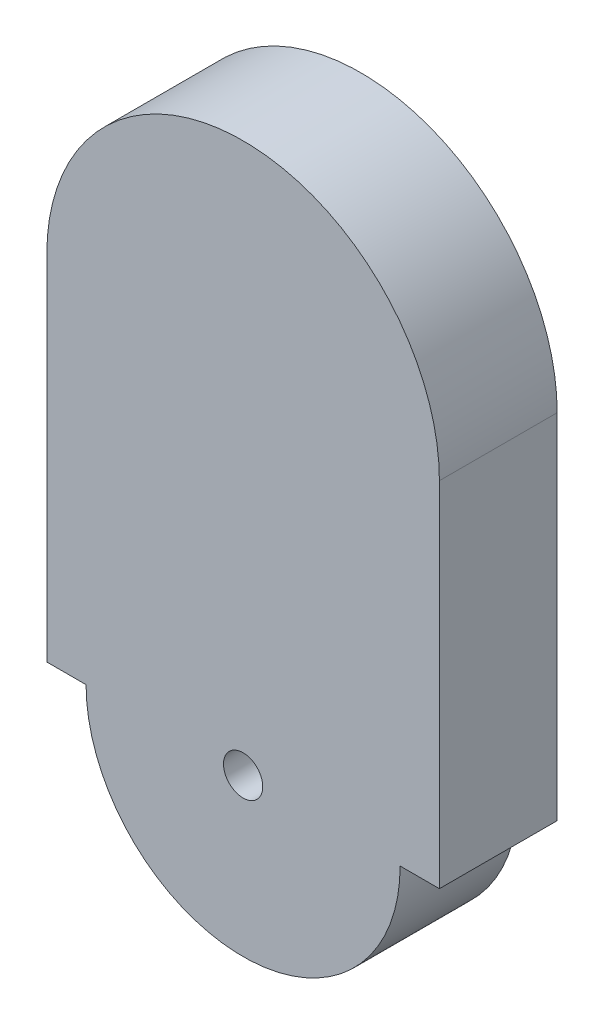
from build123d import *

# Parameters (mm, degrees)
BOSS_EXTRUDE1_DEPTH         = 19.05
F_1_4_0_25_DIAMETER_HOLE1_D = 6.35


with BuildPart() as part:
    # Sketch2 → Boss-Extrude1 (new body)
    with BuildSketch(Plane.XY):
        with BuildLine():
            Line((31.75, 28.575), (31.75, -28.575))
            Line((31.75, -28.575), (25.4, -28.575))
            ThreePointArc((25.4, -28.575), (0, -53.975), (-25.4, -28.575))
            Line((-25.4, -28.575), (-31.75, -28.575))
            Line((-31.75, -28.575), (-31.75, 28.575))
            ThreePointArc((-31.75, 28.575), (0, 60.325), (31.75, 28.575))
        make_face()
    extrude(amount=BOSS_EXTRUDE1_DEPTH)

    # 1/4 (0.25) Diameter Hole1 (through all)
    with Locations(Plane(origin=(0, 0, 0), x_dir=(-1, 0, 0), z_dir=(0, 0, -1))):
        with Locations((0, -28.575)):
            Hole(F_1_4_0_25_DIAMETER_HOLE1_D / 2)


solid = part.part
